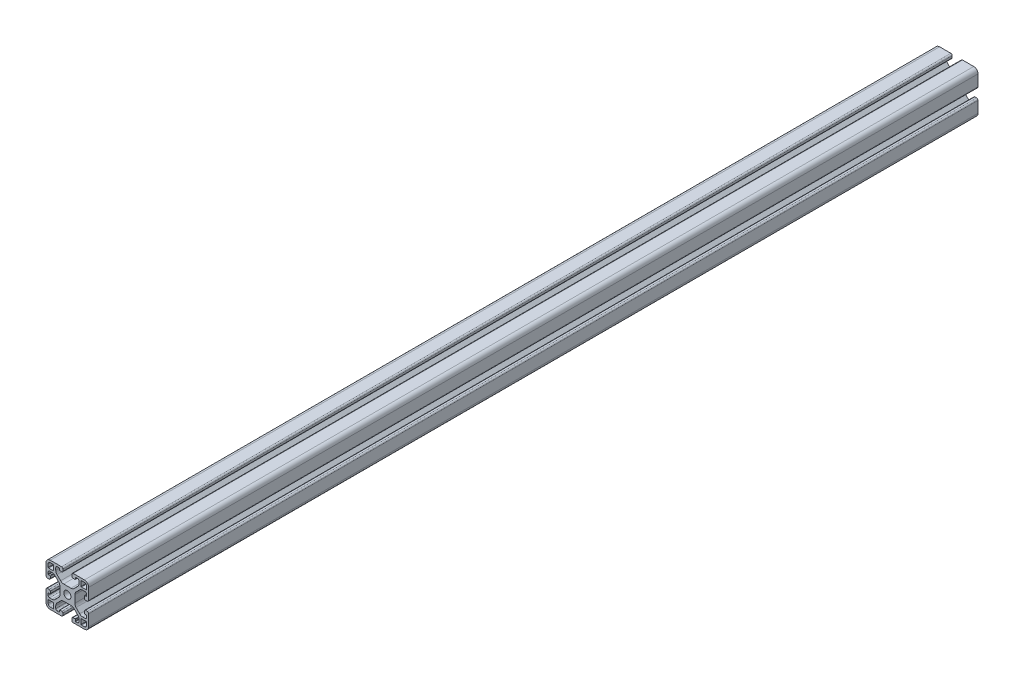
from build123d import *

# Parameters (mm, degrees)
ESQUISSE1_R        = 2.5
BOSS_EXTRU_1_DEPTH = 625


with BuildPart() as part:
    # Esquisse1 → Boss.-Extru.1 (new body)
    with BuildSketch(Plane.XY.offset(20)):
        with BuildLine():
            Line((20.3, 3), (18.9, 3))
            ThreePointArc((18.9, 3), (18.334314575, 2.765685425), (18.1, 2.2))
            Line((18.1, 2.2), (18.1, 1))
            ThreePointArc((18.1, 1), (18.392893219, 0.292893219), (19.1, 0))
            Line((19.1, 0), (27, 0))
            ThreePointArc((27, 0), (29.121320344, 0.878679656), (30, 3))
            Line((30, 3), (30, 10.9))
            ThreePointArc((30, 10.9), (29.707106781, 11.607106781), (29, 11.9))
            Line((29, 11.9), (27.8, 11.9))
            ThreePointArc((27.8, 11.9), (27.234314575, 11.665685425), (27, 11.1))
            Line((27, 11.1), (27, 9.7))
            ThreePointArc((27, 9.7), (27.087867966, 9.487867966), (27.3, 9.4))
            Line((27.3, 9.4), (28.2, 9.4))
            ThreePointArc((28.2, 9.4), (28.412132034, 9.312132034), (28.5, 9.1))
            Line((28.5, 9.1), (28.5, 7.85))
            ThreePointArc((28.5, 7.85), (28.207106781, 7.142893219), (27.5, 6.85))
            Line((27.5, 6.85), (25.806854249, 6.85))
            ThreePointArc((25.806854249, 6.85), (24.658803952, 7.078361402), (23.685533906, 7.728679656))
            Line((23.685533906, 7.728679656), (21.128679656, 10.285533906))
            ThreePointArc((21.128679656, 10.285533906), (20.478361402, 11.258803952), (20.25, 12.406854249))
            Line((20.25, 12.406854249), (20.25, 17.59314575))
            ThreePointArc((20.25, 17.59314575), (20.478361402, 18.741196048), (21.128679656, 19.714466094))
            Line((21.128679656, 19.714466094), (23.685533906, 22.271320344))
            ThreePointArc((23.685533906, 22.271320344), (24.658803952, 22.921638598), (25.80685425, 23.15))
            Line((25.80685425, 23.15), (27.5, 23.15))
            ThreePointArc((27.5, 23.15), (28.207106781, 22.857106781), (28.5, 22.15))
            Line((28.5, 22.15), (28.5, 20.9))
            ThreePointArc((28.5, 20.9), (28.412132034, 20.687867966), (28.2, 20.6))
            Line((28.2, 20.6), (27.3, 20.6))
            ThreePointArc((27.3, 20.6), (27.087867966, 20.512132034), (27, 20.3))
            Line((27, 20.3), (27, 18.9))
            ThreePointArc((27, 18.9), (27.234314575, 18.334314575), (27.8, 18.1))
            Line((27.8, 18.1), (29, 18.1))
            ThreePointArc((29, 18.1), (29.707106781, 18.392893219), (30, 19.1))
            Line((30, 19.1), (30, 27))
            ThreePointArc((30, 27), (29.121320344, 29.121320344), (27, 30))
            Line((27, 30), (19.1, 30))
            ThreePointArc((19.1, 30), (18.392893219, 29.707106781), (18.1, 29))
            Line((18.1, 29), (18.1, 27.8))
            ThreePointArc((18.1, 27.8), (18.334314575, 27.234314575), (18.9, 27))
            Line((18.9, 27), (20.3, 27))
            ThreePointArc((20.3, 27), (20.512132034, 27.087867966), (20.6, 27.3))
            Line((20.6, 27.3), (20.6, 28.2))
            ThreePointArc((20.6, 28.2), (20.687867966, 28.412132034), (20.9, 28.5))
            Line((20.9, 28.5), (22.15, 28.5))
            ThreePointArc((22.15, 28.5), (22.857106781, 28.207106781), (23.15, 27.5))
            Line((23.15, 27.5), (23.15, 25.806854249))
            ThreePointArc((23.15, 25.806854249), (22.921638598, 24.658803952), (22.271320344, 23.685533906))
            Line((22.271320344, 23.685533906), (19.714466094, 21.128679656))
            ThreePointArc((19.714466094, 21.128679656), (18.741196048, 20.478361402), (17.59314575, 20.25))
            Line((17.59314575, 20.25), (12.406854249, 20.25))
            ThreePointArc((12.406854249, 20.25), (11.258803952, 20.478361402), (10.285533906, 21.128679656))
            Line((10.285533906, 21.128679656), (7.728679656, 23.685533906))
            ThreePointArc((7.728679656, 23.685533906), (7.078361402, 24.658803952), (6.85, 25.806854249))
            Line((6.85, 25.806854249), (6.85, 27.5))
            ThreePointArc((6.85, 27.5), (7.142893219, 28.207106781), (7.85, 28.5))
            Line((7.85, 28.5), (9.1, 28.5))
            ThreePointArc((9.1, 28.5), (9.312132034, 28.412132034), (9.4, 28.2))
            Line((9.4, 28.2), (9.4, 27.3))
            ThreePointArc((9.4, 27.3), (9.487867966, 27.087867966), (9.7, 27))
            Line((9.7, 27), (11.1, 27))
            ThreePointArc((11.1, 27), (11.665685425, 27.234314575), (11.9, 27.8))
            Line((11.9, 27.8), (11.9, 29))
            ThreePointArc((11.9, 29), (11.607106781, 29.707106781), (10.9, 30))
            Line((10.9, 30), (3, 30))
            ThreePointArc((3, 30), (0.878679656, 29.121320344), (0, 27))
            Line((0, 27), (0, 19.1))
            ThreePointArc((0, 19.1), (0.292893219, 18.392893219), (1, 18.1))
            Line((1, 18.1), (2.2, 18.1))
            ThreePointArc((2.2, 18.1), (2.765685425, 18.334314575), (3, 18.9))
            Line((3, 18.9), (3, 20.3))
            ThreePointArc((3, 20.3), (2.912132034, 20.512132034), (2.7, 20.6))
            Line((2.7, 20.6), (1.8, 20.6))
            ThreePointArc((1.8, 20.6), (1.587867966, 20.687867966), (1.5, 20.9))
            Line((1.5, 20.9), (1.5, 22.15))
            ThreePointArc((1.5, 22.15), (1.792893219, 22.857106781), (2.5, 23.15))
            Line((2.5, 23.15), (4.19314575, 23.15))
            ThreePointArc((4.19314575, 23.15), (5.341196048, 22.921638598), (6.314466094, 22.271320344))
            Line((6.314466094, 22.271320344), (8.871320344, 19.714466094))
            ThreePointArc((8.871320344, 19.714466094), (9.521638598, 18.741196048), (9.75, 17.593145751))
            Line((9.75, 17.593145751), (9.75, 12.406854249))
            ThreePointArc((9.75, 12.406854249), (9.521638598, 11.258803952), (8.871320344, 10.285533906))
            Line((8.871320344, 10.285533906), (6.314466094, 7.728679656))
            ThreePointArc((6.314466094, 7.728679656), (5.341196048, 7.078361402), (4.19314575, 6.85))
            Line((4.19314575, 6.85), (2.5, 6.85))
            ThreePointArc((2.5, 6.85), (1.792893219, 7.142893219), (1.5, 7.85))
            Line((1.5, 7.85), (1.5, 9.1))
            ThreePointArc((1.5, 9.1), (1.587867966, 9.312132034), (1.8, 9.4))
            Line((1.8, 9.4), (2.7, 9.4))
            ThreePointArc((2.7, 9.4), (2.912132034, 9.487867966), (3, 9.7))
            Line((3, 9.7), (3, 11.1))
            ThreePointArc((3, 11.1), (2.765685425, 11.665685425), (2.2, 11.9))
            Line((2.2, 11.9), (1, 11.9))
            ThreePointArc((1, 11.9), (0.292893219, 11.607106781), (0, 10.9))
            Line((0, 10.9), (0, 3))
            ThreePointArc((0, 3), (0.878679656, 0.878679656), (3, 0))
            Line((3, 0), (10.9, 0))
            ThreePointArc((10.9, 0), (11.607106781, 0.292893219), (11.9, 1))
            Line((11.9, 1), (11.9, 2.2))
            ThreePointArc((11.9, 2.2), (11.665685425, 2.765685425), (11.1, 3))
            Line((11.1, 3), (9.7, 3))
            ThreePointArc((9.7, 3), (9.487867966, 2.912132034), (9.4, 2.7))
            Line((9.4, 2.7), (9.4, 1.8))
            ThreePointArc((9.4, 1.8), (9.312132034, 1.587867966), (9.1, 1.5))
            Line((9.1, 1.5), (7.85, 1.5))
            ThreePointArc((7.85, 1.5), (7.142893219, 1.792893219), (6.85, 2.5))
            Line((6.85, 2.5), (6.85, 4.19314575))
            ThreePointArc((6.85, 4.19314575), (7.078361402, 5.341196048), (7.728679656, 6.314466094))
            Line((7.728679656, 6.314466094), (10.285533906, 8.871320344))
            ThreePointArc((10.285533906, 8.871320344), (11.258803952, 9.521638598), (12.406854249, 9.75))
            Line((12.406854249, 9.75), (17.593145751, 9.75))
            ThreePointArc((17.593145751, 9.75), (18.741196048, 9.521638598), (19.714466094, 8.871320344))
            Line((19.714466094, 8.871320344), (22.271320344, 6.314466094))
            ThreePointArc((22.271320344, 6.314466094), (22.921638598, 5.341196048), (23.15, 4.193145751))
            Line((23.15, 4.193145751), (23.15, 2.5))
            ThreePointArc((23.15, 2.5), (22.857106781, 1.792893219), (22.15, 1.5))
            Line((22.15, 1.5), (20.9, 1.5))
            ThreePointArc((20.9, 1.5), (20.687867966, 1.587867966), (20.6, 1.8))
            Line((20.6, 1.8), (20.6, 2.7))
            ThreePointArc((20.6, 2.7), (20.512132034, 2.912132034), (20.3, 3))
        make_face()
        with Locations(Location((15, 15, 0), (0, 0, 180))):
            Circle(ESQUISSE1_R, mode=Mode.SUBTRACT)
        with BuildLine():
            Line((5.35, 5.05), (5.35, 1.8))
            ThreePointArc((5.35, 1.8), (5.262132034, 1.587867966), (5.05, 1.5))
            Line((5.05, 1.5), (3, 1.5))
            ThreePointArc((3, 1.5), (1.939339828, 1.939339828), (1.5, 3))
            Line((1.5, 3), (1.5, 5.05))
            ThreePointArc((1.5, 5.05), (1.587867966, 5.262132034), (1.8, 5.35))
            Line((1.8, 5.35), (5.05, 5.35))
            ThreePointArc((5.05, 5.35), (5.262132034, 5.262132034), (5.35, 5.05))
        make_face(mode=Mode.SUBTRACT)
        with BuildLine():
            Line((24.95, 5.35), (28.2, 5.35))
            ThreePointArc((28.2, 5.35), (28.412132034, 5.262132034), (28.5, 5.05))
            Line((28.5, 5.05), (28.5, 3))
            ThreePointArc((28.5, 3), (28.060660172, 1.939339828), (27, 1.5))
            Line((27, 1.5), (24.95, 1.5))
            ThreePointArc((24.95, 1.5), (24.737867966, 1.587867966), (24.65, 1.8))
            Line((24.65, 1.8), (24.65, 5.05))
            ThreePointArc((24.65, 5.05), (24.737867966, 5.262132034), (24.95, 5.35))
        make_face(mode=Mode.SUBTRACT)
        with BuildLine():
            Line((24.65, 24.95), (24.65, 28.2))
            ThreePointArc((24.65, 28.2), (24.737867966, 28.412132034), (24.95, 28.5))
            Line((24.95, 28.5), (27, 28.5))
            ThreePointArc((27, 28.5), (28.060660172, 28.060660172), (28.5, 27))
            Line((28.5, 27), (28.5, 24.95))
            ThreePointArc((28.5, 24.95), (28.412132034, 24.737867966), (28.2, 24.65))
            Line((28.2, 24.65), (24.95, 24.65))
            ThreePointArc((24.95, 24.65), (24.737867966, 24.737867966), (24.65, 24.95))
        make_face(mode=Mode.SUBTRACT)
        with BuildLine():
            Line((5.05, 24.65), (1.8, 24.65))
            ThreePointArc((1.8, 24.65), (1.587867966, 24.737867966), (1.5, 24.95))
            Line((1.5, 24.95), (1.5, 27))
            ThreePointArc((1.5, 27), (1.939339828, 28.060660172), (3, 28.5))
            Line((3, 28.5), (5.05, 28.5))
            ThreePointArc((5.05, 28.5), (5.262132034, 28.412132034), (5.35, 28.2))
            Line((5.35, 28.2), (5.35, 24.95))
            ThreePointArc((5.35, 24.95), (5.262132034, 24.737867966), (5.05, 24.65))
        make_face(mode=Mode.SUBTRACT)
    extrude(amount=-BOSS_EXTRU_1_DEPTH)


solid = part.part
